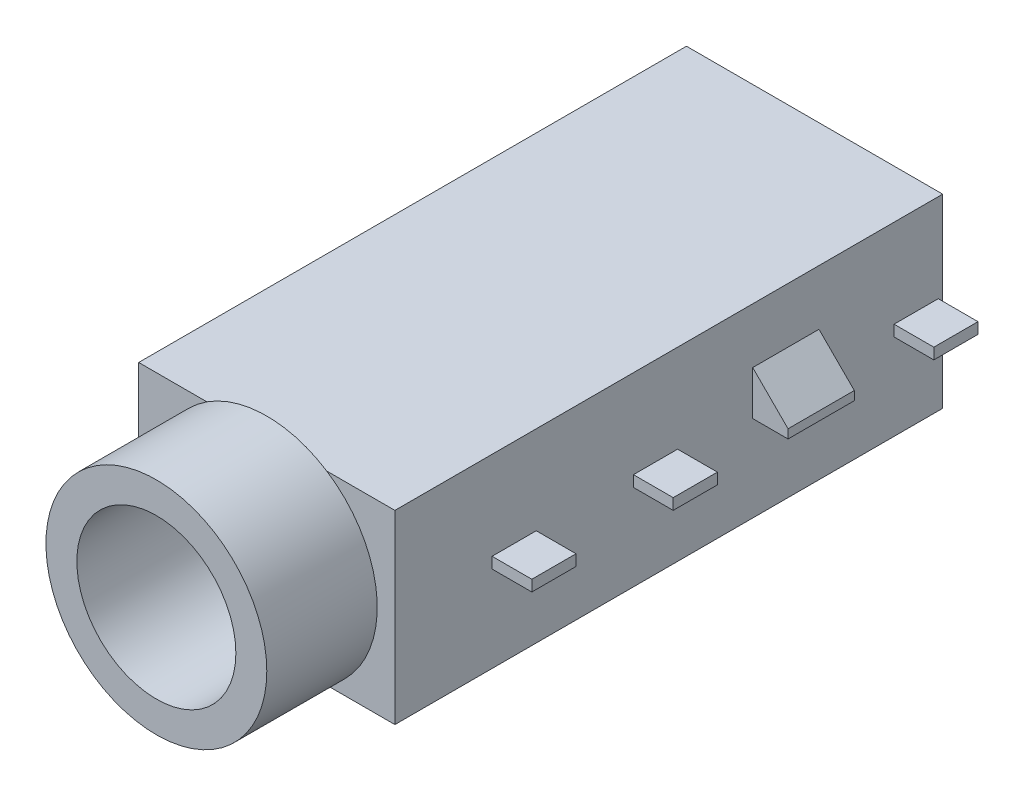
from build123d import *

# Parameters (mm, degrees)
SKETCH_1_W          = 5.8
SKETCH_1_H          = 12.4
EXTRUDE_1_DEPTH     = 4.2
SKETCH_2_R          = 2.5
EXTRUDE_2_DEPTH     = 2.5
SKETCH_4_W          = 1
SKETCH_4_H          = 0.25
EXTRUDE_4_DEPTH     = 0.9
SKETCH_5_R          = 1.8
CUT_EXTRUDE_1_DEPTH = 17.050233643
SKETCH_6_W          = 1.5
SKETCH_6_H          = 1
EXTRUDE_5_DEPTH     = 0.8
CUT_EXTRUDE_2_DEPTH = 1.5


with BuildPart() as part:
    # 草图1 → 凸台-拉伸1 (new body)
    with BuildSketch(Plane(origin=(0, 0, 0), x_dir=(1, 0, 0), z_dir=(0, 1, 0))):
        with Locations((0, 6.2)):
            Rectangle(SKETCH_1_W, SKETCH_1_H)
    extrude(amount=EXTRUDE_1_DEPTH)

    # 草图2 → 凸台-拉伸2 (add)
    with BuildSketch(Plane.XY):
        with Locations(Location((0, 2.1, 0), (0, 0, 122.859880379))):
            Circle(SKETCH_2_R)
    extrude(amount=EXTRUDE_2_DEPTH)

    # 草图4 → 凸台-拉伸4 (add)
    with BuildSketch(Plane(origin=(2.9, 0, 0), x_dir=(0, 0, -1), z_dir=(1, 0, 0))):
        with Locations((2.7, 2.075)):
            Rectangle(SKETCH_4_W, SKETCH_4_H)
        with Locations((5.9, 2.075)):
            Rectangle(SKETCH_4_W, SKETCH_4_H)
        with Locations((11.8, 2.075)):
            Rectangle(SKETCH_4_W, SKETCH_4_H)
    extrude_4 = extrude(amount=EXTRUDE_4_DEPTH)

    # 草图5 → 切除-拉伸1 (cut, through all)
    with BuildSketch(Plane.XY.offset(2.5)):
        with Locations((0, 2.1)):
            Circle(SKETCH_5_R)
    extrude(amount=-CUT_EXTRUDE_1_DEPTH, mode=Mode.SUBTRACT)

    # 草图6 → 凸台-拉伸5 (add)
    with BuildSketch(Plane(origin=(2.9, 0, 0), x_dir=(0, 0, -1), z_dir=(1, 0, 0))):
        with Locations((8.85, 2.45)):
            Rectangle(SKETCH_6_W, SKETCH_6_H)
    extrude_5 = extrude(amount=EXTRUDE_5_DEPTH)

    # 草图7 → 切除-拉伸2 (cut)
    with BuildSketch(Plane(origin=(0, 0, -9.6), x_dir=(-1, 0, 0), z_dir=(0, 0, -1))):
        Polygon((-3.7, 2.95), (-2.9, 2.95), (-3.7, 2.15), align=None)
    cut_extrude_2 = extrude(amount=-CUT_EXTRUDE_2_DEPTH, mode=Mode.SUBTRACT)

    # 镜向1: 凸台-拉伸4, 凸台-拉伸5, 切除-拉伸2 across plane
    add(extrude_4.mirror(Plane(origin=(0, 0, 0), x_dir=(0, 0, 1), z_dir=(1, 0, 0))))
    add(extrude_5.mirror(Plane(origin=(0, 0, 0), x_dir=(0, 0, 1), z_dir=(1, 0, 0))))
    add(cut_extrude_2.mirror(Plane(origin=(0, 0, 0), x_dir=(0, 0, 1), z_dir=(1, 0, 0))), mode=Mode.SUBTRACT)


solid = part.part
